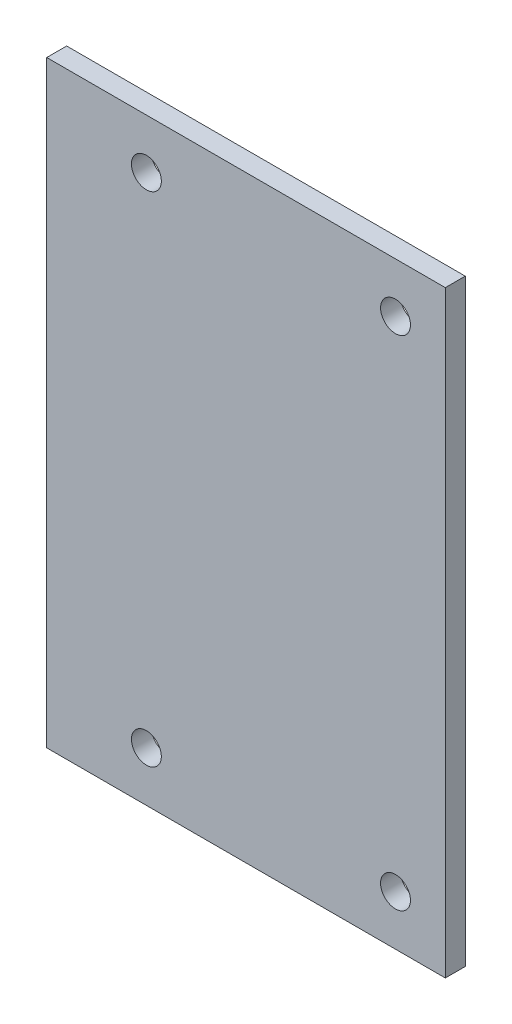
from build123d import *

# Parameters (mm, degrees)
SKETCH_1_W      = 40
SKETCH_1_H      = 60
SKETCH_1_R      = 1.5
EXTRUDE_2_DEPTH = 2


with BuildPart() as part:
    # 草图1 → 凸台-拉伸2 (new body)
    with BuildSketch(Plane.XY):
        with Locations((20, 30)):
            Rectangle(SKETCH_1_W, SKETCH_1_H)
        with Locations((10, 55)):
            Circle(SKETCH_1_R, mode=Mode.SUBTRACT)
        with Locations((35, 55)):
            Circle(SKETCH_1_R, mode=Mode.SUBTRACT)
        with Locations(Location((10, 5, 0), (0, 0, 180))):
            Circle(SKETCH_1_R, mode=Mode.SUBTRACT)
        with Locations(Location((35, 5, 0), (0, 0, 180))):
            Circle(SKETCH_1_R, mode=Mode.SUBTRACT)
    extrude(amount=EXTRUDE_2_DEPTH)


solid = part.part
